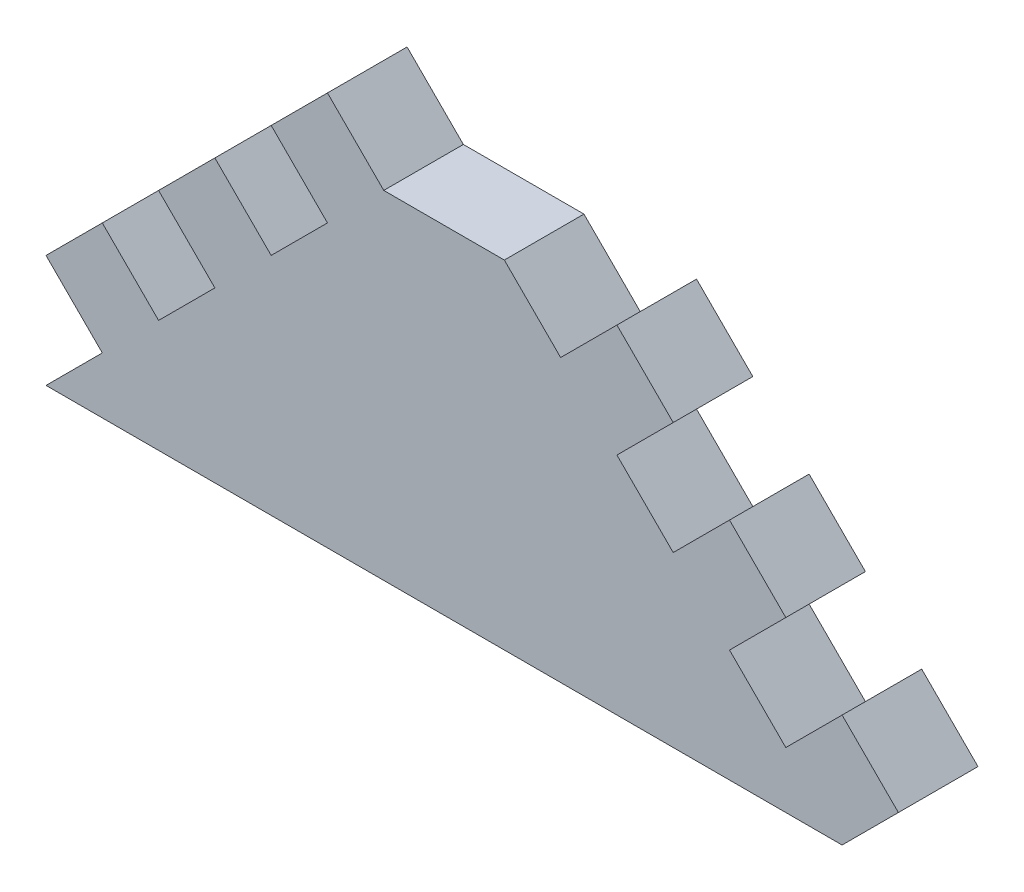
from build123d import *

# Parameters (mm, degrees)
EXTRUDE_1_DEPTH = 5


with BuildPart() as part:
    # Эскиз1 → Бобышка-Вытянуть1 (new body)
    with BuildSketch(Plane.XY):
        Polygon((0, 0), (50, 0), (53.535533906, 3.535533906), (50, 7.071067812), (46.464466094, 3.535533906), (42.928932188, 7.071067812), (46.464466094, 10.606601718), (42.928932188, 14.142135624), (39.393398282, 10.606601718), (35.857864376, 14.142135624), (39.393398282, 17.67766953), (35.857864376, 21.213203436), (32.32233047, 17.67766953), (28.786796564, 21.213203436), (21.213203436, 21.213203436), (17.67766953, 24.748737342), (14.142135624, 21.213203436), (17.67766953, 17.67766953), (14.142135624, 14.142135624), (10.606601718, 17.67766953), (7.071067812, 14.142135624), (10.606601718, 10.606601718), (7.071067812, 7.071067812), (3.535533906, 10.606601718), (0, 7.071067812), (3.535533906, 3.535533906), align=None)
    extrude(amount=EXTRUDE_1_DEPTH)


solid = part.part
